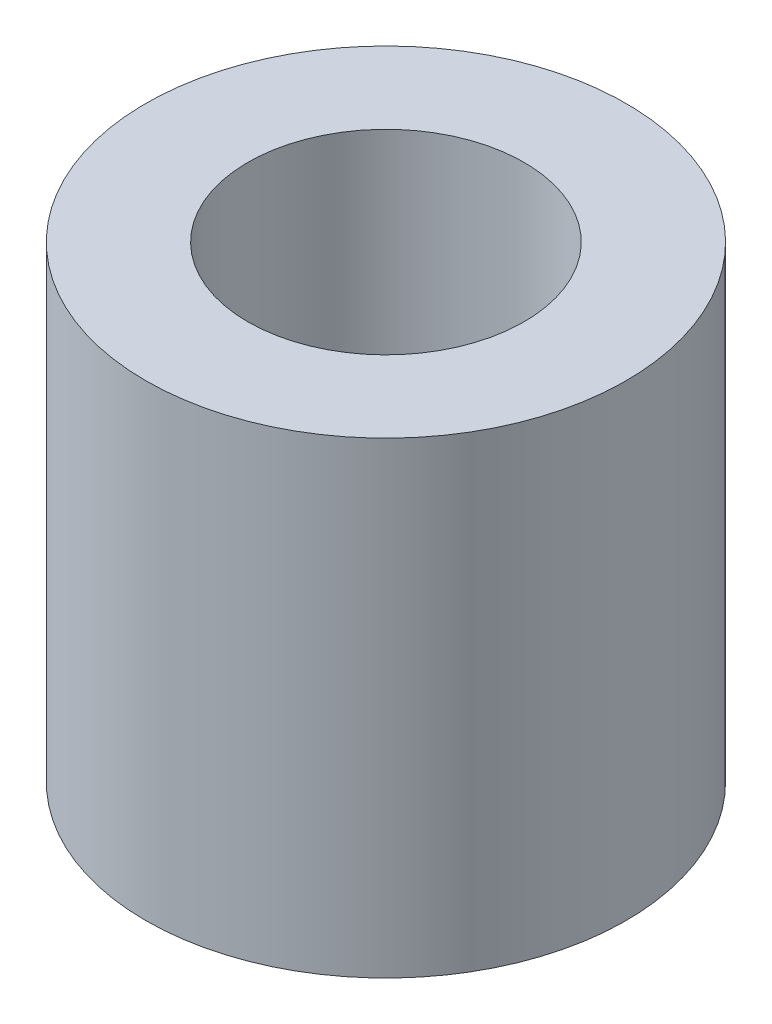
from build123d import *

# Parameters (mm, degrees)
SKETCH1_R           = 5.65
SKETCH1_R_2         = 3.25
BOSS_EXTRUDE1_DEPTH = 11


with BuildPart() as part:
    # Sketch1 → Boss-Extrude1 (new body)
    with BuildSketch(Plane(origin=(0, 0, 0), x_dir=(1, 0, 0), z_dir=(0, 1, 0))):
        with Locations(Location((0, 0, 0), (0, 0, 270))):
            Circle(SKETCH1_R)
        with Locations(Location((0, 0, 0), (0, 0, 270))):
            Circle(SKETCH1_R_2, mode=Mode.SUBTRACT)
    extrude(amount=BOSS_EXTRUDE1_DEPTH)


solid = part.part
